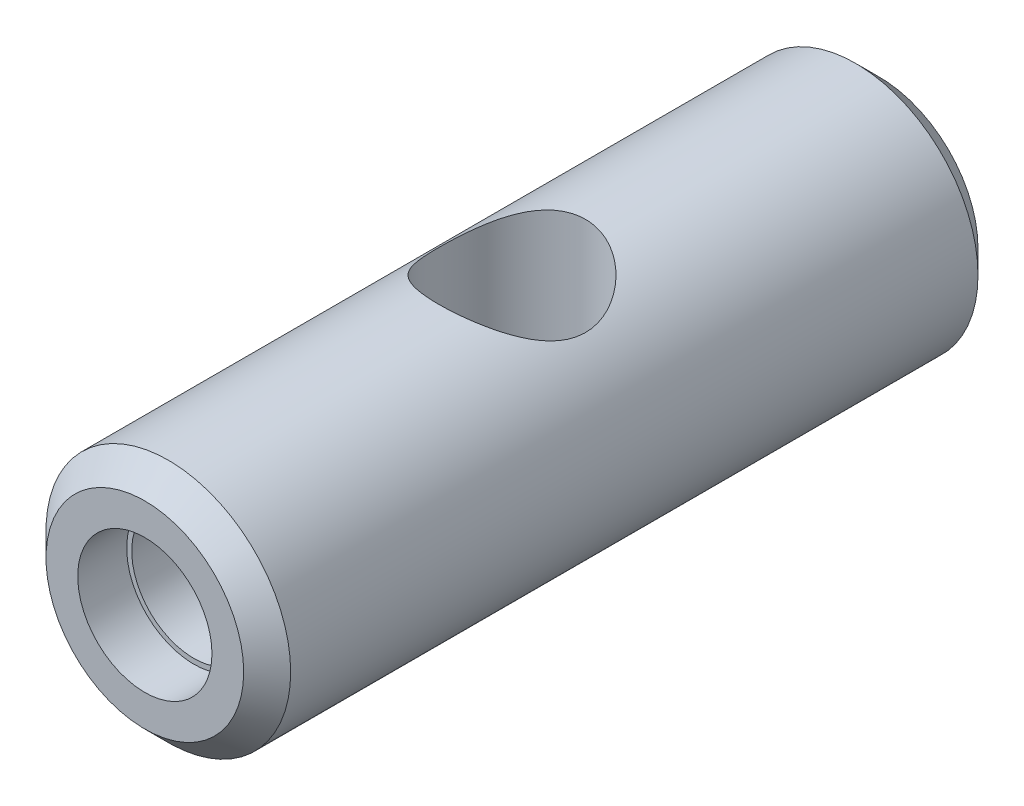
from build123d import *

# Parameters (mm, degrees)
SKETCH1_R           = 7.934325
BOSS_EXTRUDE1_DEPTH = 47.625
SKETCH3_R           = 4.76885
CUT_EXTRUDE1_DEPTH  = 14.2875
SKETCH2_R           = 4.0259
CUT_EXTRUDE2_DEPTH  = 25.4
SKETCH5_R           = 4.352925
CUT_EXTRUDE3_DEPTH  = 3.175
CHAMFER1_SIZE       = 1.524


with BuildPart() as part:
    # Sketch1 → Boss-Extrude1 (new body)
    with BuildSketch(Plane.XY):
        Circle(SKETCH1_R)
    extrude(amount=-BOSS_EXTRUDE1_DEPTH)

    # Sketch3 → Cut-Extrude1 (cut, symmetric)
    with BuildSketch(Plane(origin=(0, 0, 0), x_dir=(1, 0, 0), z_dir=(0, 1, 0))):
        with Locations(Location((0, 23.8125, 0), (0, 0, 270))):
            Circle(SKETCH3_R)
    extrude(amount=CUT_EXTRUDE1_DEPTH, both=True, mode=Mode.SUBTRACT)

    # Sketch2 → Cut-Extrude2 (cut)
    with BuildSketch(Plane.XY):
        Circle(SKETCH2_R)
    extrude(amount=-CUT_EXTRUDE2_DEPTH, mode=Mode.SUBTRACT)

    # Sketch5 → Cut-Extrude3 (cut)
    with BuildSketch(Plane.XY):
        Circle(SKETCH5_R)
    extrude(amount=-CUT_EXTRUDE3_DEPTH, mode=Mode.SUBTRACT)

    # Chamfer1
    chamfer1_edges = [part.edges().sort_by_distance(p)[0] for p in [
        (-7.934325, 0, 0),
        (-7.934325, 0, -47.625),
    ]]
    chamfer(chamfer1_edges, length=CHAMFER1_SIZE)


solid = part.part
